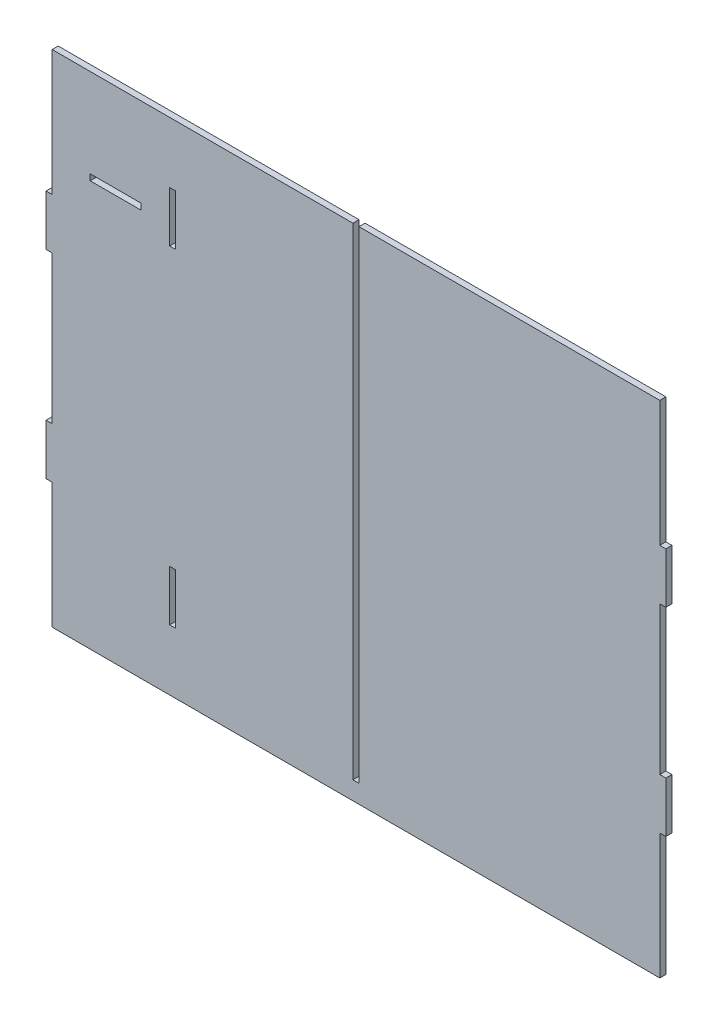
from build123d import *

# Parameters (mm, degrees)
SKETCH1_W           = 6
SKETCH1_H           = 50
SKETCH1_W_2         = 50
SKETCH1_H_2         = 6
BOSS_EXTRUDE1_DEPTH = 6


with BuildPart() as part:
    # Sketch1 → Boss-Extrude1 (new body)
    with BuildSketch(Plane.XY):
        Polygon((0, 0), (297, 0), (297, -476), (303, -476), (303, 0), (600, 0), (600, -124), (606, -124), (606, -174), (600, -174), (600, -320), (606, -320), (606, -370), (600, -370), (600, -494), (0, -494), (0, -370), (-6, -370), (-6, -320), (0, -320), (0, -174), (-6, -174), (-6, -124), (0, -124), align=None)
        with Locations((119, -409)):
            Rectangle(SKETCH1_W, SKETCH1_H, mode=Mode.SUBTRACT)
        with Locations((119, -85)):
            Rectangle(SKETCH1_W, SKETCH1_H, mode=Mode.SUBTRACT)
        with Locations((62.5, -90.5)):
            Rectangle(SKETCH1_W_2, SKETCH1_H_2, mode=Mode.SUBTRACT)
    extrude(amount=BOSS_EXTRUDE1_DEPTH)


solid = part.part
